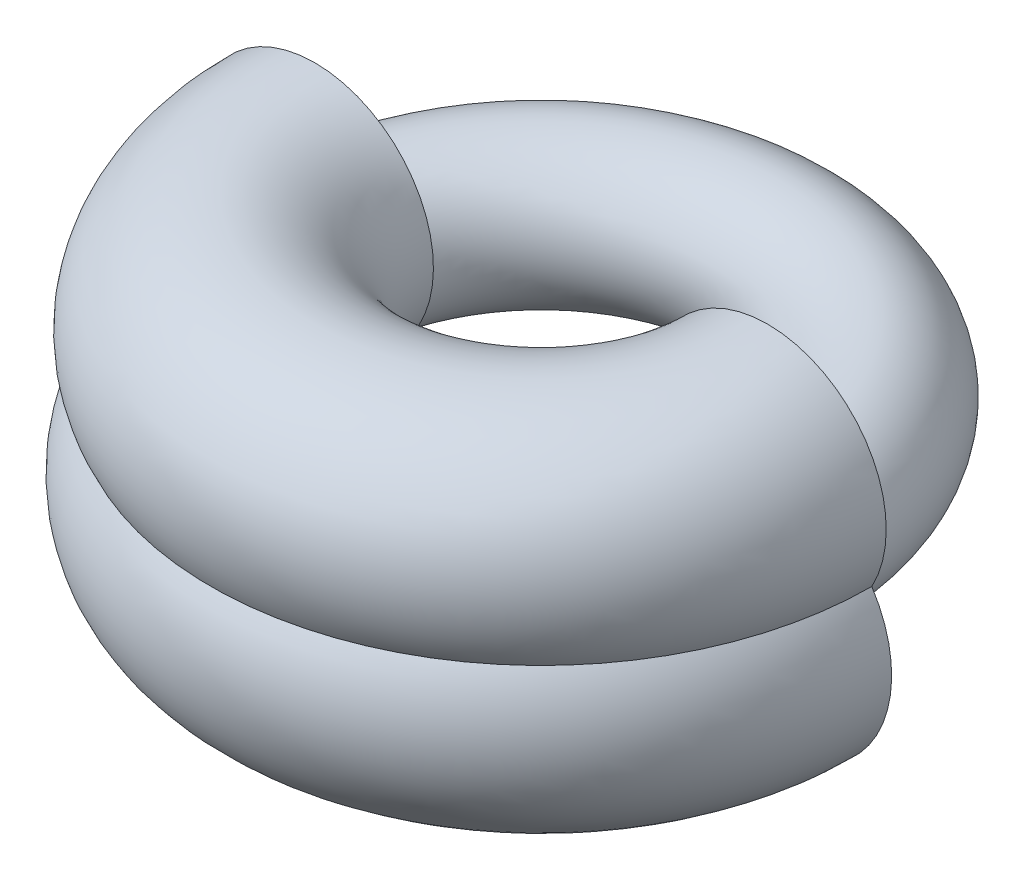
from build123d import *

# Parameters (mm, degrees)
REVOLVE4_ANGLE = 180
SKETCH3_R      = 7.79168693
REVOLVE5_ANGLE = 180


with BuildPart() as part:
    # Sketch1 → Revolve4 (revolve)
    with BuildSketch(Plane.XY):
        with BuildLine():
            ThreePointArc((12.848680198, 23.082879541), (23.782571169, 2.995405058), (34.716462141, 23.082879541))
            ThreePointArc((34.716462141, 23.082879541), (23.782571169, 41.483040718), (12.848680198, 23.082879541))
        make_face()
    revolve(axis=Axis((0, 50.729758663, 0), (0, -1, 0)), revolution_arc=REVOLVE4_ANGLE)

    # Sketch3 → Revolve5 (revolve)
    with BuildSketch(Plane(origin=(0, 0, 0), x_dir=(-1, 0, 0), z_dir=(0, 0, -1))):
        with Locations((-24.667675494, 22.992737091)):
            Circle(SKETCH3_R)
    revolve(axis=Axis((0, 0, 0), (0, 1, 0)), revolution_arc=REVOLVE5_ANGLE)


solid = part.part
